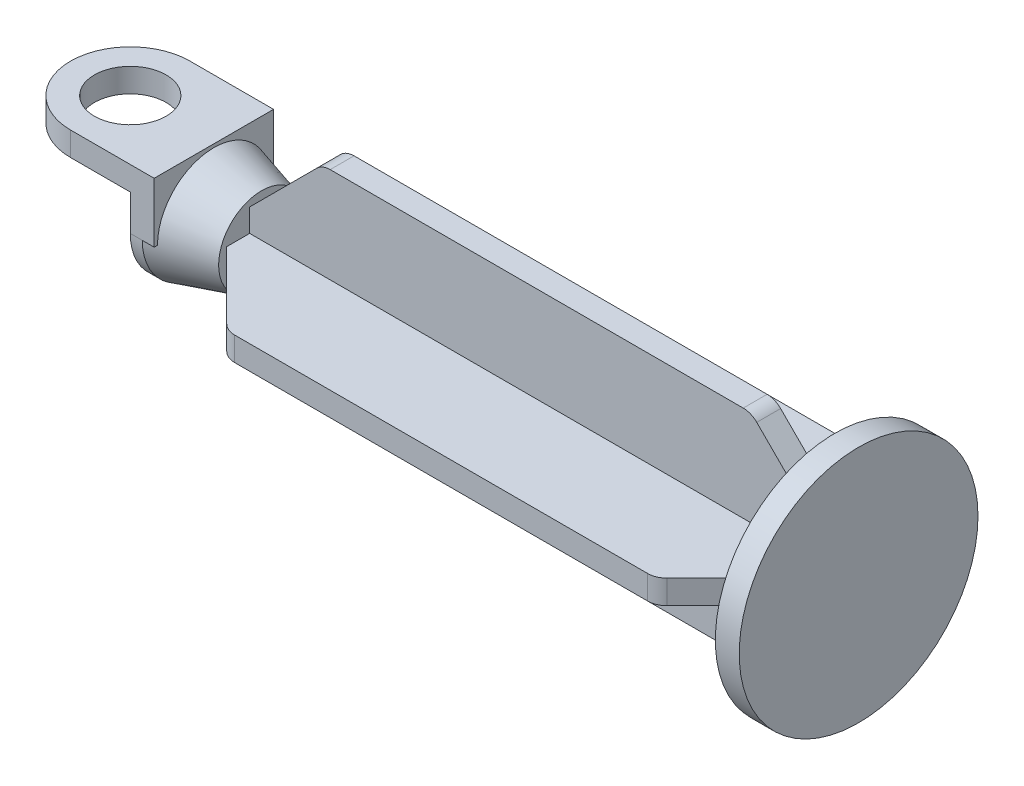
from build123d import *

# Parameters (mm, degrees)
SKETCH1_R            = 15.875
BOSS_EXTRUDE1_DEPTH  = 3.175
SKETCH5_W            = 3.175
SKETCH5_H            = 14.2875
BOSS_EXTRUDE3_DEPTH  = 76.2
CUT_EXTRUDE1_DEPTH   = 80.770887743
CIRPATTERN2_COUNT    = 4
BOSS_EXTRUDE21_DEPTH = 1.6002
SKETCH18_W           = 3.175
SKETCH18_H           = 7.9375
CUT_EXTRUDE7_DEPTH   = 7.9375
SKETCH19_W           = 15.875
SKETCH19_H           = 3.175
BOSS_EXTRUDE22_DEPTH = 7.9375
SKETCH20_R           = 4.7625
CUT_EXTRUDE8_DEPTH   = 106.553828833


with BuildPart() as part:
    # Sketch1 → Boss-Extrude1 (new body)
    with BuildSketch(Plane(origin=(0, 0, 0), x_dir=(0, 0, -1), z_dir=(1, 0, 0))):
        Circle(SKETCH1_R)
    extrude(amount=BOSS_EXTRUDE1_DEPTH)

    # Sketch5 → Boss-Extrude3 (add)
    with BuildSketch(Plane.ZY):
        with Locations((0, 7.14375)):
            Rectangle(SKETCH5_W, SKETCH5_H)
    boss_extrude3 = extrude(amount=BOSS_EXTRUDE3_DEPTH)

    # Sketch6 → Cut-Extrude1 (cut, symmetric)
    with BuildSketch(Plane.XY.offset(1.5875)):
        with BuildLine():
            Line((0, 14.2875), (-10.577102448, 14.2875))
            ThreePointArc((-10.577102448, 14.2875), (-9.60508653, 14.094154013), (-8.781051224, 13.543551224))
            Line((-8.781051224, 13.543551224), (-1.886948776, 6.649448776))
            ThreePointArc((-1.886948776, 6.649448776), (-1.06291347, 6.098845987), (-0.090897552, 5.9055))
            Line((-0.090897552, 5.9055), (0, 5.9055))
            Line((0, 5.9055), (0, 14.2875))
        make_face()
        with BuildLine():
            ThreePointArc((-67.291948776, 13.543551224), (-66.46791347, 14.094154013), (-65.495897552, 14.2875))
            Line((-65.495897552, 14.2875), (-76.2, 14.2875))
            Line((-76.2, 14.2875), (-76.2, 4.6355))
            Line((-76.2, 4.6355), (-67.291948776, 13.543551224))
        make_face()
    cut_extrude1 = extrude(amount=CUT_EXTRUDE1_DEPTH, both=True, mode=Mode.SUBTRACT)

    # CirPattern2: Boss-Extrude3, Cut-Extrude1 ×4 about axis
    cirpattern2_axis = Axis((0, 0, 0), (1, 0, 0))
    add([boss_extrude3.rotate(cirpattern2_axis, i * 360 / CIRPATTERN2_COUNT) for i in range(1, CIRPATTERN2_COUNT)])
    add([cut_extrude1.rotate(cirpattern2_axis, i * 360 / CIRPATTERN2_COUNT) for i in range(1, CIRPATTERN2_COUNT)], mode=Mode.SUBTRACT)

    # Sketch8 → Revolve1 (revolve)
    with BuildSketch(Plane.XY):
        Polygon((-76.2, 0), (-84.1248, 0), (-84.1248, 7.9375), (-76.2, 5.715), align=None)
    revolve(axis=Axis((0, 0, 0), (-1, 0, 0)))

    # Sketch17 → Boss-Extrude21 (add)
    with BuildSketch(Plane.ZY.offset(84.1248)):
        with BuildLine():
            Line((-7.9375, 0), (7.9375, 0))
            ThreePointArc((7.9375, 0), (0, -7.9375), (-7.9375, 0))
        make_face()
    extrude(amount=BOSS_EXTRUDE21_DEPTH)

    # Sketch18 → Cut-Extrude7 (cut, symmetric)
    with BuildSketch(Plane.XY):
        with Locations((-84.1375, 3.96875)):
            Rectangle(SKETCH18_W, SKETCH18_H)
    extrude(amount=CUT_EXTRUDE7_DEPTH, both=True, mode=Mode.SUBTRACT)

    # Sketch19 → Boss-Extrude22 (add, symmetric)
    with BuildSketch(Plane.XY):
        with Locations((-93.6625, 6.35)):
            Rectangle(SKETCH19_W, SKETCH19_H)
        Polygon((-85.725, 7.9375), (-82.55, 7.9375), (-82.55, 0), (-85.725, 0), (-85.725, 4.7625), align=None)
    extrude(amount=BOSS_EXTRUDE22_DEPTH, both=True)

    # Sketch20 → Cut-Extrude8 (cut, through all)
    with BuildSketch(Plane(origin=(0, 7.9375, 0), x_dir=(-1, 0, 0), z_dir=(0, 1, 0))):
        with BuildLine():
            ThreePointArc((101.6, 0), (99.275160076, -5.612660076), (93.6625, -7.9375))
            Line((93.6625, -7.9375), (101.6, -7.9375))
            Line((101.6, -7.9375), (101.6, 0))
        make_face()
        with BuildLine():
            ThreePointArc((93.6625, 7.9375), (99.275160076, 5.612660076), (101.6, 0))
            Line((101.6, 0), (101.6, 7.9375))
            Line((101.6, 7.9375), (93.6625, 7.9375))
        make_face()
        with Locations(Location((93.6625, 0, 0), (0, 0, 90))):
            Circle(SKETCH20_R)
    extrude(amount=-CUT_EXTRUDE8_DEPTH, mode=Mode.SUBTRACT)


solid = part.part
